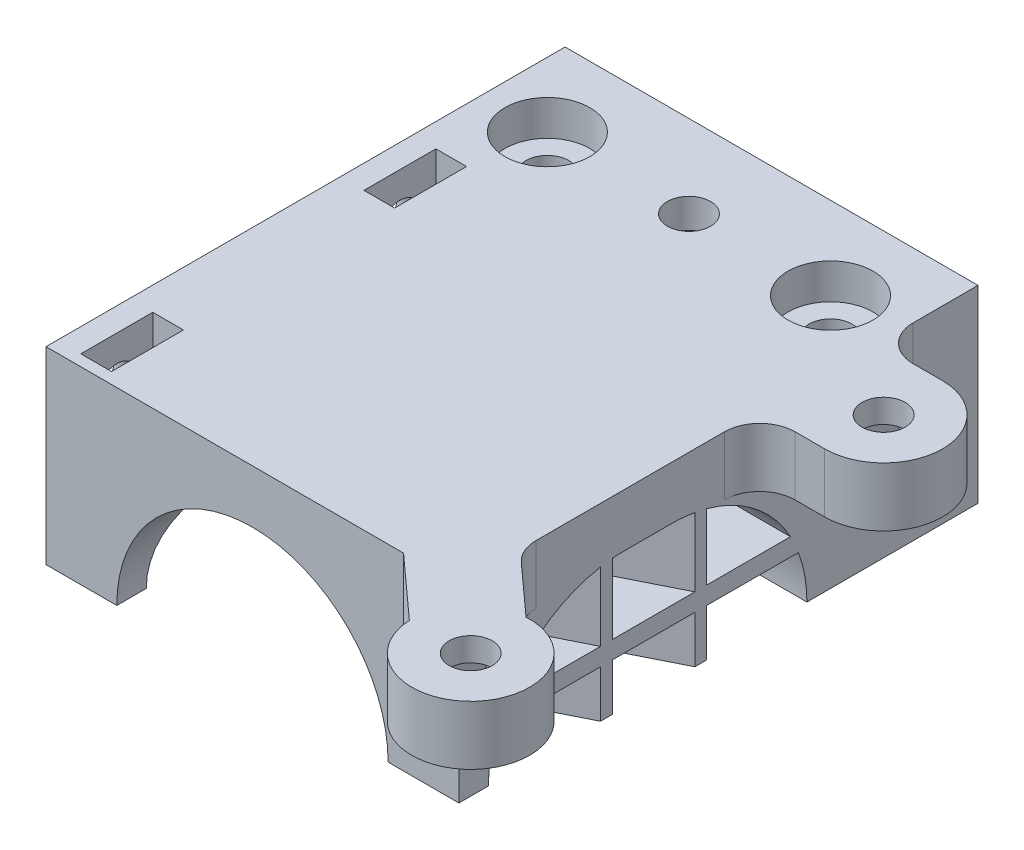
from build123d import *

# Parameters (mm, degrees)
SKETCH12_W                = 35
SKETCH12_H                = 44
CHAMBER_DEPTH             = 16
SKETCH13_R                = 11.5
BODY_DEPTH                = 31
HOT_END_TONEL_DEPTH       = 76.538069872
SKETCH26_W                = 27
SKETCH26_H                = 1.5
GRID_V_DEPTH              = 6
GRID_H_DEPTH              = 16
SKETCH16_R                = 13.5
SKETCH18_R                = 11.5
SKETCH20_R                = 8.125
HOT_END_1_DEPTH           = 3.2
SKETCH21_R                = 7
HOT_END_2_DEPTH           = 5.6
SKETCH22_R                = 8.125
HOT_END_3_DEPTH           = 4.2
SKETCH24_R                = 1.825
MOUNT_HOLES_DEPTH         = 71.156967099
SKETCH25_R                = 1.75
FAN_MOUNT_HOLES_DEPTH     = 8
FAN_MOUNT_NUT_HOLES_START = -2
FAN_MOUNT_NUT_HOLES_DEPTH = 2.6
SKETCH32_R                = 1.825
HOT_END_SCREW_HOLE_DEPTH  = 20
HOT_END_NUT_HOLE_START    = 2.5
HOT_END_NUT_HOLE_DEPTH    = 2.6
SKETCH35_R                = 1.825
BOSS_EXTRUDE1_DEPTH       = 5
CUT_EXTRUDE5_DEPTH        = 3
SKETCH37_R                = 3.6
CUT_EXTRUDE6_DEPTH        = 3
FILLET1_R                 = 3


with BuildPart() as part:
    # Sketch12 → chamber (new body)
    with BuildSketch(Plane(origin=(0, 0, 0), x_dir=(-1, 0, 0), z_dir=(0, -1, 0))):
        with Locations((3.5, -43)):
            Rectangle(SKETCH12_W, SKETCH12_H)
    extrude(amount=-CHAMBER_DEPTH)

    # Sketch13 → body (cut)
    with BuildSketch(Plane.XY.offset(65)):
        with Locations((-3.5, 16)):
            Circle(SKETCH13_R)
    extrude(amount=-BODY_DEPTH, mode=Mode.SUBTRACT)

    # Sketch14 → hot-end-tonel (cut, through all)
    with BuildSketch(Plane(origin=(14, 0, 0), x_dir=(0, 0, -1), z_dir=(1, 0, 0))):
        with BuildLine():
            Line((-51, 27.5), (-47, 27.5))
            ThreePointArc((-47, 27.5), (-35.5, 16), (-47, 4.5))
            Line((-47, 4.5), (-51, 4.5))
            ThreePointArc((-51, 4.5), (-62.5, 16), (-51, 27.5))
        make_face()
    extrude(amount=-HOT_END_TONEL_DEPTH, mode=Mode.SUBTRACT)

    # Sketch26 → grid-v (add)
    with BuildSketch(Plane(origin=(14, 0, 0), x_dir=(0, 0, -1), z_dir=(1, 0, 0))):
        with Locations((-49, 11.25)):
            Rectangle(SKETCH26_W, SKETCH26_H)
    extrude(amount=-GRID_V_DEPTH)

    # Sketch27 → grid-h (add)
    with BuildSketch(Plane.XZ):
        Polygon((8, 56), (14, 53), (14, 52), (8, 55), align=None)
        Polygon((14, 44), (8, 47), (8, 48), (14, 45), align=None)
    extrude(amount=-GRID_H_DEPTH)

    # Sketch16 → Cut-Loft1 section 0
    with BuildSketch(Plane(origin=(-21, 0, 0), x_dir=(0, 0, -1), z_dir=(1, 0, 0))):
        with Locations((-49, 16)):
            Circle(SKETCH16_R)
    # Sketch18 → Cut-Loft1 section 1
    with BuildSketch(Plane.ZY.offset(17)):
        with Locations((49, 16)):
            Circle(SKETCH18_R)
    loft(mode=Mode.SUBTRACT)

    # Sketch20 → hot-end-1 (cut)
    with BuildSketch(Plane.XY.offset(34)):
        with Locations((-3.5, 16)):
            Circle(SKETCH20_R)
    extrude(amount=-HOT_END_1_DEPTH, mode=Mode.SUBTRACT)

    # Sketch21 → hot-end-2 (cut)
    with BuildSketch(Plane.XY.offset(30.8)):
        with Locations((-3.5, 16)):
            Circle(SKETCH21_R)
    extrude(amount=-HOT_END_2_DEPTH, mode=Mode.SUBTRACT)

    # Sketch22 → hot-end-3 (cut)
    with BuildSketch(Plane.XY.offset(25.2)):
        with Locations((-3.5, 16)):
            Circle(SKETCH22_R)
    extrude(amount=-HOT_END_3_DEPTH, mode=Mode.SUBTRACT)

    # Sketch24 → mount-holes (cut, through all)
    with BuildSketch(Plane.XZ):
        with Locations((-15.5, 28)):
            Circle(SKETCH24_R)
        with Locations((8.5, 28)):
            Circle(SKETCH24_R)
    extrude(amount=-MOUNT_HOLES_DEPTH, mode=Mode.SUBTRACT)

    # Sketch25 → fan-mount-holes (cut)
    with BuildSketch(Plane.ZY.offset(21)):
        with Locations((60.999999795, 4)):
            Circle(SKETCH25_R)
        with Locations((36.999999795, 4)):
            Circle(SKETCH25_R)
    extrude(amount=-FAN_MOUNT_HOLES_DEPTH, mode=Mode.SUBTRACT)

    # Sketch34 → fan-mount-nut-holes (cut)
    with BuildSketch(Plane.ZY.offset(21).offset(FAN_MOUNT_NUT_HOLES_START)):
        Polygon((33.949999795, 0), (40.049999795, 0), (40.049999795, 5.760918321), (36.999999795, 7.521836642), (33.949999795, 5.760918321), align=None)
        Polygon((64.049999795, 0), (64.049999795, 5.760918321), (60.999999795, 7.521836642), (57.949999795, 5.760918321), (57.949999795, 0), align=None)
    extrude(amount=-FAN_MOUNT_NUT_HOLES_DEPTH, mode=Mode.SUBTRACT)


with BuildPart() as body_2:
    # Mirror1: mirrored copy
    add(part.part.mirror(Plane.ZX.offset(16)))

    # Sketch32 → hot-end-screw-hole (cut)
    with BuildSketch(Plane(origin=(0, 32, 0), x_dir=(-1, 0, 0), z_dir=(0, -1, 0))):
        with Locations((3.5, -28)):
            Circle(SKETCH32_R)
    extrude(amount=HOT_END_SCREW_HOLE_DEPTH, mode=Mode.SUBTRACT)

    # Sketch33 → hot-end-nut-hole (cut)
    with BuildSketch(Plane.XZ.offset(-32).offset(HOT_END_NUT_HOLE_START)):
        Polygon((-6.55, 21), (-0.45, 21), (-0.45, 29.760918321), (-3.5, 31.521836642), (-6.55, 29.760918321), align=None)
    extrude(amount=HOT_END_NUT_HOLE_DEPTH, mode=Mode.SUBTRACT)

    # Sketch35 → Boss-Extrude1 (add)
    # profile 1 of 2: a face of its own
    with BuildSketch(Plane(origin=(0, 32, 0), x_dir=(1, 0, 0), z_dir=(0, 1, 0))):
        with BuildLine():
            Line((9.305077899, -65), (14.504047822, -69.701151268))
            ThreePointArc((14.504047822, -69.701151268), (23.208629379, -72.853515786), (19.198969923, -64.509070137))
            Line((19.198969923, -64.509070137), (14, -59.807918869))
            Line((14, -59.807918869), (9.305077899, -65))
        make_face()
        with Locations((19.5, -69.5)):
            Circle(SKETCH35_R, mode=Mode.SUBTRACT)
    # profile 2 of 2: a face of its own
    with BuildSketch(Plane(origin=(0, 32, 0), x_dir=(1, 0, 0), z_dir=(0, 1, 0))):
        with BuildLine():
            Line((14, -39.5), (14, -29.5))
            Line((14, -29.5), (19.5, -29.5))
            ThreePointArc((19.5, -29.5), (24.5, -34.5), (19.5, -39.5))
            Line((19.5, -39.5), (14, -39.5))
        make_face()
        with Locations((19.5, -34.5)):
            Circle(SKETCH35_R, mode=Mode.SUBTRACT)
    extrude(amount=-BOSS_EXTRUDE1_DEPTH)

    # Sketch36 → Cut-Extrude5 (cut)
    with BuildSketch(Plane.XZ.offset(-27)):
        Polygon((17.739081679, 31.45), (21.260918321, 31.45), (23.021836642, 34.5), (21.260918321, 37.55), (17.739081679, 37.55), (15.978163358, 34.5), align=None)
        Polygon((23.021836642, 69.5), (21.260918321, 72.55), (17.739081679, 72.55), (15.978163358, 69.5), (17.739081679, 66.45), (21.260918321, 66.45), align=None)
    extrude(amount=-CUT_EXTRUDE5_DEPTH, mode=Mode.SUBTRACT)

    # Sketch37 → Cut-Extrude6 (cut)
    with BuildSketch(Plane(origin=(0, 32, 0), x_dir=(1, 0, 0), z_dir=(0, 1, 0))):
        with Locations((-15.5, -28)):
            Circle(SKETCH37_R)
        with Locations((8.5, -28)):
            Circle(SKETCH37_R)
    extrude(amount=-CUT_EXTRUDE6_DEPTH, mode=Mode.SUBTRACT)

    # Fillet1
    fillet1_edges = [body_2.edges().sort_by_distance(p)[0] for p in [
        (14, 29.5, 59.807918869),
        (14, 29.5, 29.5),
        (14, 29.5, 39.5),
    ]]
    fillet(fillet1_edges, radius=FILLET1_R)


solid = body_2.part
